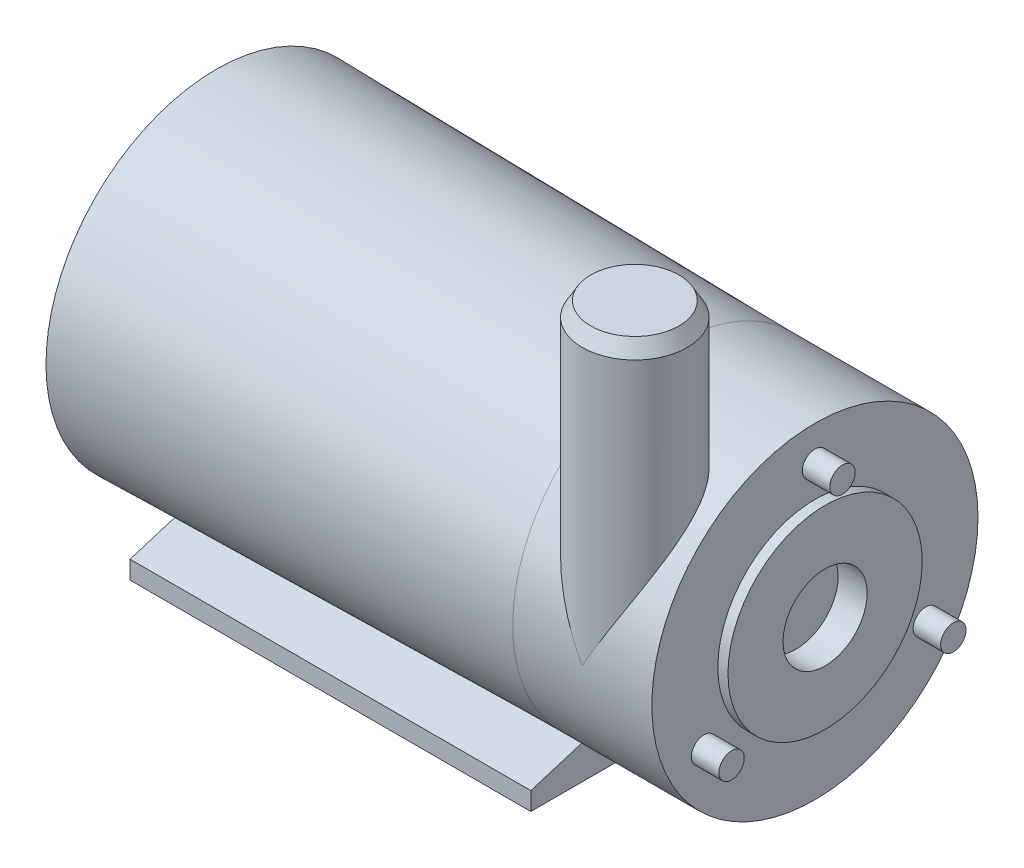
from build123d import *

# Parameters (mm, degrees)
SKETCH1_R           = 11.25
BOSS_EXTRUDE1_DEPTH = 9.6
SKETCH2_R           = 3.625
BOSS_EXTRUDE2_DEPTH = 20
SKETCH3_R           = 6.7
BOSS_EXTRUDE3_DEPTH = 0.7
SKETCH4_R           = 0.875
BOSS_EXTRUDE4_DEPTH = 1.9
SKETCH5_R           = 2.9
CUT_EXTRUDE1_DEPTH  = 2
BOSS_EXTRUDE5_DEPTH = 27.65
CHAMFER1_SIZE2      = 0.577350269
CHAMFER1_SIZE       = 1


with BuildPart() as part:
    # Sketch1 → Boss-Extrude1 (new body)
    with BuildSketch(Plane(origin=(0, 0, 0), x_dir=(0, 0, -1), z_dir=(1, 0, 0))):
        Circle(SKETCH1_R)
    extrude(amount=-BOSS_EXTRUDE1_DEPTH)

    # Sketch2 → Boss-Extrude2 (add)
    with BuildSketch(Plane(origin=(0, 0, 0), x_dir=(1, 0, 0), z_dir=(0, 1, 0))):
        with Locations(Location((-4.8, -7.625, 0), (0, 0, 270))):
            Circle(SKETCH2_R)
    extrude(amount=BOSS_EXTRUDE2_DEPTH)

    # Sketch3 → Boss-Extrude3 (add)
    with BuildSketch(Plane(origin=(0, 0, 0), x_dir=(0, 0, -1), z_dir=(1, 0, 0))):
        Circle(SKETCH3_R)
    extrude(amount=BOSS_EXTRUDE3_DEPTH)

    # Sketch4 → Boss-Extrude4 (add)
    with BuildSketch(Plane(origin=(0, 0, 0), x_dir=(0, 0, -1), z_dir=(1, 0, 0))):
        with Locations(Location((0, 8.833459119, 0), (0, 0, 180))):
            Circle(SKETCH4_R)
        with Locations(Location((7.65, -4.416729559, 0), (0, 0, 180))):
            Circle(SKETCH4_R)
        with Locations(Location((-7.65, -4.416729559, 0), (0, 0, 180))):
            Circle(SKETCH4_R)
    extrude(amount=BOSS_EXTRUDE4_DEPTH)

    # Sketch5 → Cut-Extrude1 (cut)
    with BuildSketch(Plane(origin=(0.7, 0, 0), x_dir=(0, 0, -1), z_dir=(1, 0, 0))):
        Circle(SKETCH5_R)
    extrude(amount=-CUT_EXTRUDE1_DEPTH, mode=Mode.SUBTRACT)

    # Sketch7 → Revolve1 (revolve)
    with BuildSketch(Plane.XY):
        Polygon((-9.6, 0), (-9.6, 11.25), (-41.3, 11.75), (-41.3, 0), align=None)
    revolve(axis=Axis((-9.6, 0, 0), (-1, 0, 0)))

    # Sketch8 → Boss-Extrude5 (add)
    with BuildSketch(Plane(origin=(-9.6, 0, 0), x_dir=(0, 0, -1), z_dir=(1, 0, 0))):
        Polygon((-10, -11.75), (10, -11.75), (10, -10.5), (3.216946356, -8.409910385), (-3.216946356, -8.409910385), (-10, -10.5), align=None)
    extrude(amount=-BOSS_EXTRUDE5_DEPTH)

    # Chamfer1
    chamfer1_edges = [part.edges().sort_by_distance(p)[0] for p in [
        (-4.8, 20, 4),
    ]]
    chamfer(chamfer1_edges, length=CHAMFER1_SIZE, length2=CHAMFER1_SIZE2)


solid = part.part
